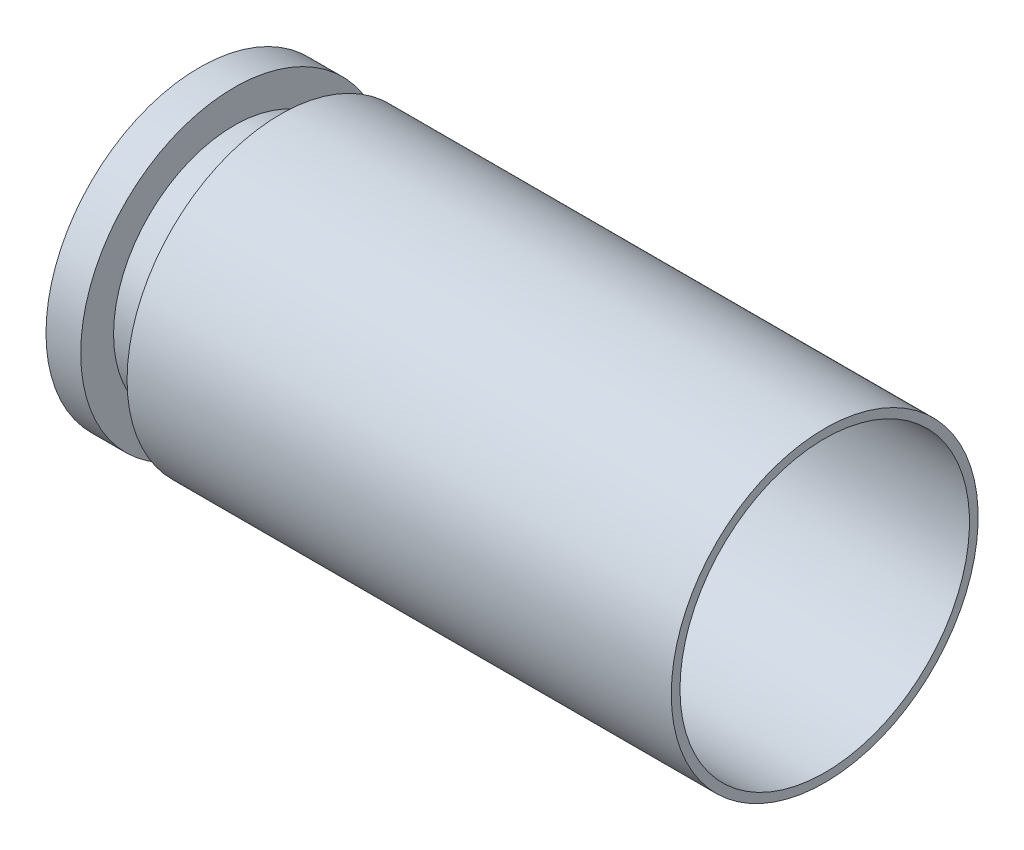
from build123d import *


with BuildPart() as part:
    # Esboço1 → Revolução1 (revolve)
    with BuildSketch(Plane.XY, mode=Mode.PRIVATE) as revolu_o1_sk:
        Polygon((4.2, 1), (4.2, 5), (21.6, 5), (21.6, 5.3), (2.8, 5.3), (2.8, 4.166428494), (1.2, 4.166428494), (1.2, 5.3), (0, 5.3), (0, 2.26), (3, 2.26), (3, 1), align=None)
    revolve(revolu_o1_sk.sketch.rotate(Axis((0, 0, 0), (1, 0, 0)), 90), axis=Axis((0, 0, 0), (1, 0, 0)))


solid = part.part
